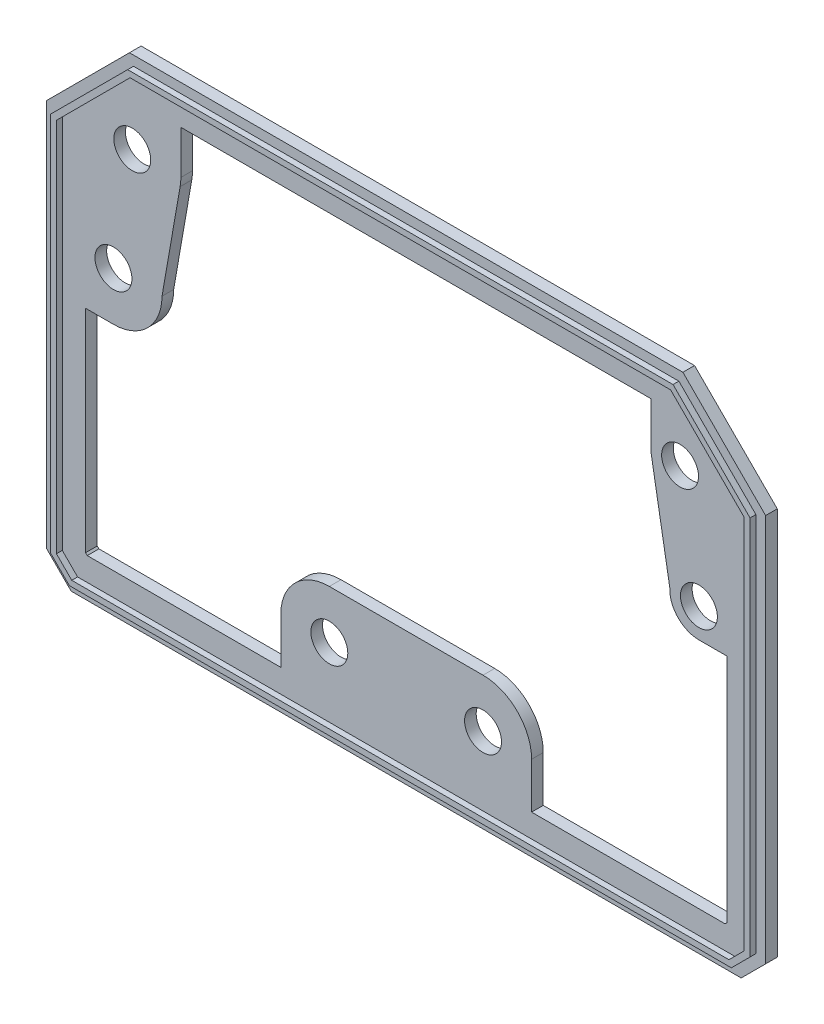
from build123d import *

# Parameters (mm, degrees)
SKETCH1_R           = 1.9
BOSS_EXTRUDE1_DEPTH = 1.2
BOSS_EXTRUDE2_DEPTH = 0.6


with BuildPart() as part:
    # Sketch1 → Boss-Extrude1 (new body)
    with BuildSketch(Plane.XY):
        Polygon((-68, 2.514718626), (-65.485281374, 0), (3.485281374, 0), (6, 2.514718626), (6, 42.485281374), (-2.514718626, 51), (-59.485281374, 51), (-68, 42.485281374), align=None)
        with Locations((-0.865721015, 30.964560447)):
            Circle(SKETCH1_R, mode=Mode.SUBTRACT)
        with Locations((-61.134278985, 30.964560447)):
            Circle(SKETCH1_R, mode=Mode.SUBTRACT)
        with Locations((-38.909782256, 8.710806253)):
            Circle(SKETCH1_R, mode=Mode.SUBTRACT)
        with Locations((-23.090217744, 8.710806253)):
            Circle(SKETCH1_R, mode=Mode.SUBTRACT)
        with Locations((-2.804444182, 42.527253566)):
            Circle(SKETCH1_R, mode=Mode.SUBTRACT)
        with Locations((-59.195555818, 42.527253566)):
            Circle(SKETCH1_R, mode=Mode.SUBTRACT)
        with BuildLine():
            Line((2, 27.964560447), (-0.865721015, 27.964560447))
            ThreePointArc((-0.865721015, 27.964560447), (-3.039785544, 28.897329588), (-3.861916537, 31.115598164))
            Line((-3.861916537, 31.115598164), (-5.759945542, 42.01246068))
            ThreePointArc((-5.759945542, 42.01246068), (-5.793298819, 42.268897298), (-5.804444182, 42.527253566))
            Line((-5.804444182, 42.527253566), (-5.804444182, 47))
            Line((-5.804444182, 47), (-54.195555818, 47))
            Line((-54.195555818, 47), (-54.195555818, 42.527253566))
            ThreePointArc((-54.195555818, 42.527253566), (-54.214131423, 42.096659786), (-54.269720219, 41.669265423))
            Line((-54.269720219, 41.669265423), (-56.134278985, 30.964560447))
            ThreePointArc((-56.134278985, 30.964560447), (-57.598745079, 27.429026541), (-61.134278985, 25.964560447))
            Line((-61.134278985, 25.964560447), (-64, 25.964560447))
            Line((-64, 25.964560447), (-64, 4.171572875))
            Line((-64, 4.171572875), (-63.828427125, 4))
            Line((-63.828427125, 4), (-43.909782256, 4))
            Line((-43.909782256, 4), (-43.909782256, 8.710806253))
            ThreePointArc((-43.909782256, 8.710806253), (-42.445316162, 12.246340159), (-38.909782256, 13.710806253))
            Line((-38.909782256, 13.710806253), (-23.090217744, 13.710806253))
            ThreePointArc((-23.090217744, 13.710806253), (-19.554683838, 12.246340159), (-18.090217744, 8.710806253))
            Line((-18.090217744, 8.710806253), (-18.090217744, 4))
            Line((-18.090217744, 4), (1.828427125, 4))
            Line((1.828427125, 4), (2, 4.171572875))
            Line((2, 4.171572875), (2, 27.964560447))
        make_face(mode=Mode.SUBTRACT)
    extrude(amount=BOSS_EXTRUDE1_DEPTH)

    # Sketch2 → Boss-Extrude2 (add)
    with BuildSketch(Plane.XY.offset(1.2)):
        Polygon((-67, 42.071067812), (-67, 2.928932188), (-65.071067812, 1), (3.071067812, 1), (5, 2.928932188), (5, 42.071067812), (-2.928932188, 50), (-59.071067812, 50), align=None)
        Polygon((-66.4, 41.822539674), (-66.4, 3.177460326), (-64.822539674, 1.6), (2.822539674, 1.6), (4.4, 3.177460326), (4.4, 41.822539674), (-3.177460326, 49.4), (-58.822539674, 49.4), align=None, mode=Mode.SUBTRACT)
    extrude(amount=BOSS_EXTRUDE2_DEPTH)


solid = part.part
